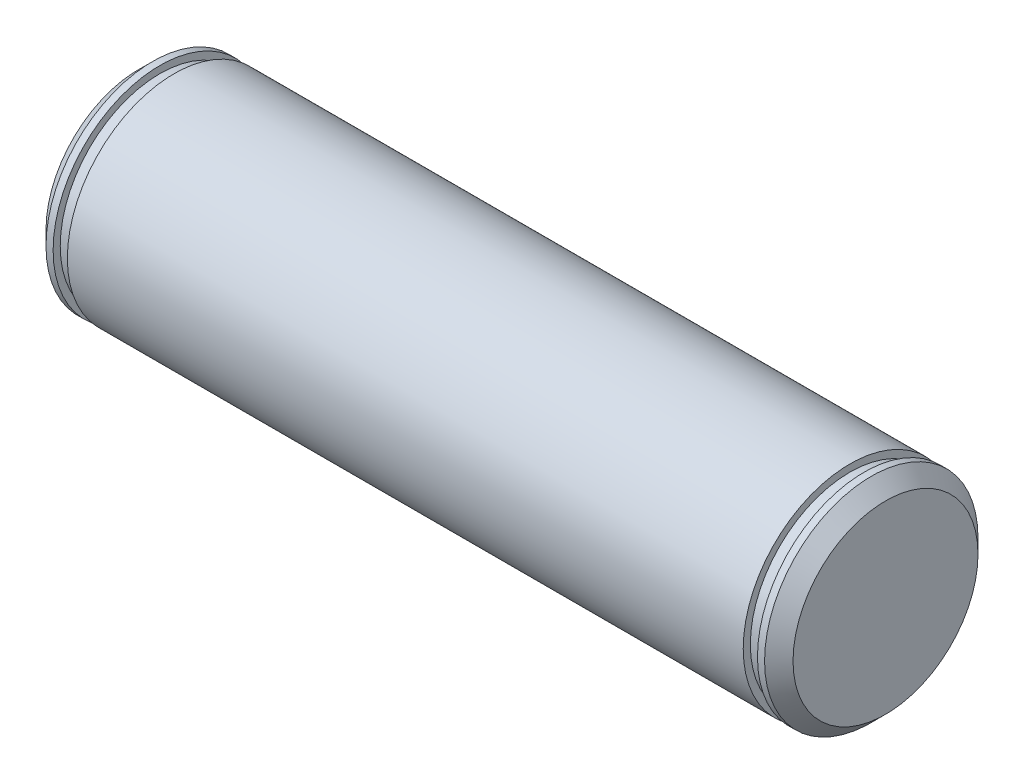
from build123d import *


with BuildPart() as part:
    # Sketch1 → Revolve1 (revolve)
    with BuildSketch(Plane.XY, mode=Mode.PRIVATE) as revolve1_sk:
        Polygon((-52.5, 0), (-52.5, 13), (-50.5, 15), (-49.5, 15), (-49.5, 14), (-47.5, 14), (-47.5, 15), (47.5, 15), (47.5, 14), (49.5, 14), (49.5, 15), (50.5, 15), (52.5, 13), (52.5, 0), align=None)
    revolve(revolve1_sk.sketch.rotate(Axis((-52.5, 0, 0), (1, 0, 0)), 90), axis=Axis((-52.5, 0, 0), (1, 0, 0)))


solid = part.part
